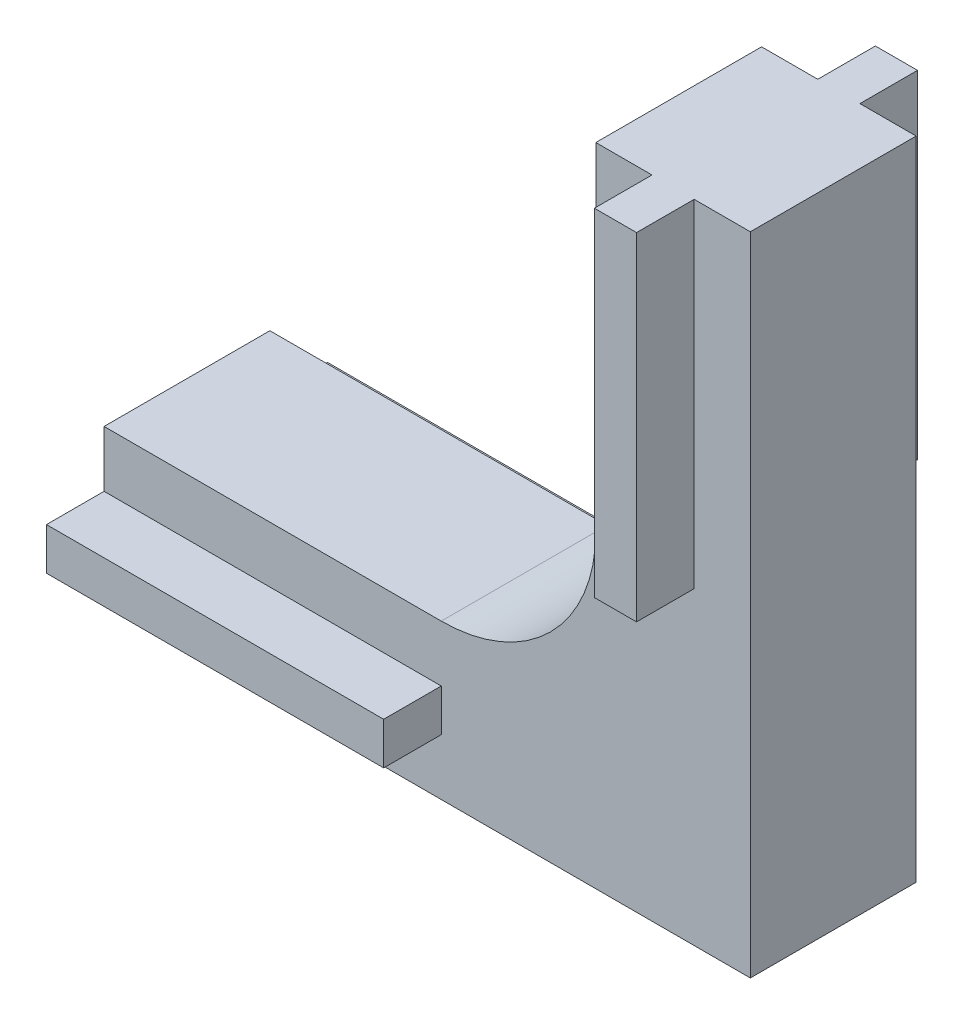
from build123d import *

# Parameters (mm, degrees)
BOSS_EXTRUDE1_DEPTH = 5.9
SKETCH2_W           = 12
SKETCH2_H           = 1.5
SKETCH2_W_2         = 1.5
SKETCH2_H_2         = 12
BOSS_EXTRUDE2_DEPTH = 2.05


with BuildPart() as part:
    # Sketch1 → Boss-Extrude1 (new body)
    with BuildSketch(Plane.XY):
        with BuildLine():
            Line((0, 5.5), (12, 5.5))
            ThreePointArc((12, 5.5), (15.889087297, 7.110912703), (17.5, 11))
            Line((17.5, 11), (17.5, 23))
            Line((17.5, 23), (23, 23))
            Line((23, 23), (23, 0))
            Line((23, 0), (0, 0))
            Line((0, 0), (0, 5.5))
        make_face()
    extrude(amount=BOSS_EXTRUDE1_DEPTH)

    # Sketch2 → Boss-Extrude2 (add)
    with BuildSketch(Plane.XY.offset(5.9)):
        with Locations((6, 2.75)):
            Rectangle(SKETCH2_W, SKETCH2_H)
        with Locations((20.25, 17)):
            Rectangle(SKETCH2_W_2, SKETCH2_H_2)
    boss_extrude2 = extrude(amount=BOSS_EXTRUDE2_DEPTH)

    # Mirror1: Boss-Extrude2 across plane
    add(boss_extrude2.mirror(Plane.XY.offset(2.95)))


solid = part.part
